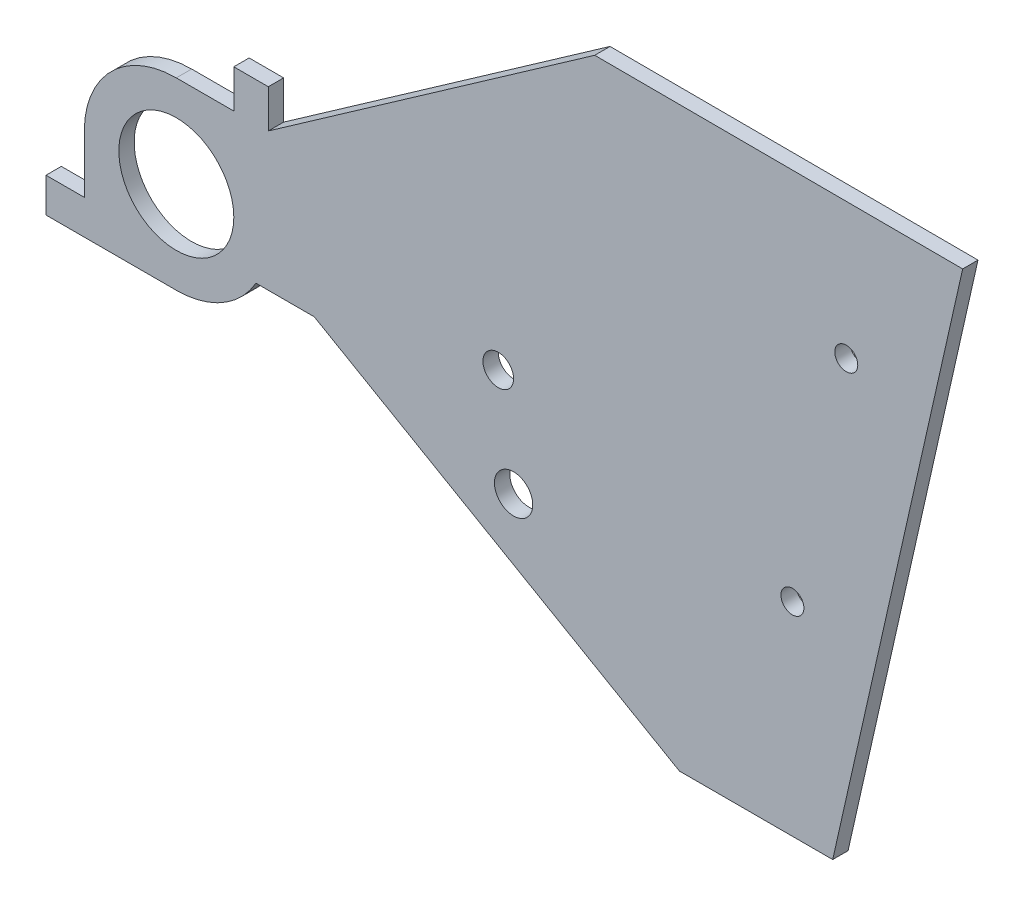
from build123d import *

# Parameters (mm, degrees)
EXTRUDE_START   = 25
SKETCH_2_R      = 2
SKETCH_2_R_2    = 7.5
SKETCH_2_R_3    = 2.5
SKETCH_2_R_4    = 1.5
EXTRUDE_1_DEPTH = 2


with BuildPart() as part:
    # 草图2 → 凸台-拉伸1 (new body)
    with BuildSketch(Plane.XY.offset(EXTRUDE_START)):
        with BuildLine():
            Line((27, -3), (27, 2))
            Line((27, 2), (22.5, 2))
            Line((22.5, 2), (22.5, -3))
            Line((22.5, -3), (15, -3))
            ThreePointArc((15, -3), (6.514718626, -6.514718626), (3, -15))
            Line((3, -15), (3, -22.5))
            Line((3, -22.5), (-2, -22.5))
            Line((-2, -22.5), (-2, -27))
            Line((-2, -27), (15, -27))
            ThreePointArc((15, -27), (21, -25.392304845), (25.392304845, -21))
            Line((25.392304845, -21), (33, -21))
            Line((33, -21), (80.631397208, -48.5))
            Line((80.631397208, -48.5), (100.631397208, -48.5))
            Line((100.631397208, -48.5), (117.584077602, 26.706974803))
            Line((117.584077602, 26.706974803), (69.584077602, 26.842860701))
            Line((69.584077602, 26.842860701), (27, -3))
        make_face()
        with Locations((57, -15)):
            Circle(SKETCH_2_R, mode=Mode.SUBTRACT)
        with Locations((15, -15)):
            Circle(SKETCH_2_R_2, mode=Mode.SUBTRACT)
        with Locations((59, -28)):
            Circle(SKETCH_2_R_3, mode=Mode.SUBTRACT)
        with Locations((102.39866677, 8.999892909)):
            Circle(SKETCH_2_R_4, mode=Mode.SUBTRACT)
        with Locations((95.373546557, -21.983660567)):
            Circle(SKETCH_2_R_4, mode=Mode.SUBTRACT)
    extrude(amount=EXTRUDE_1_DEPTH)


solid = part.part
